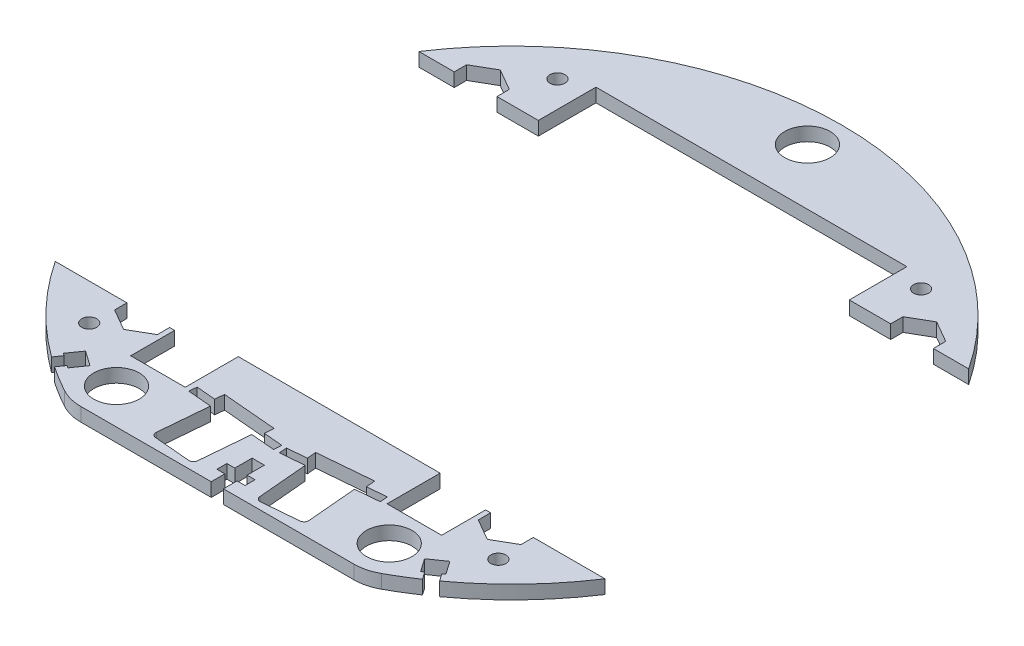
from build123d import *

# Parameters (mm, degrees)
BOSS_EXTRUDE1_DEPTH = 3
CUT_EXTRUDE1_DEPTH  = 103.574363269
SKETCH3_W           = 38.3
SKETCH3_H           = 80
CUT_EXTRUDE2_DEPTH  = 103.574363269
CUT_EXTRUDE3_DEPTH  = 95.453692358
CUT_EXTRUDE4_DEPTH  = 95.453692358
SKETCH6_W           = 68.4
SKETCH6_H           = 3
CUT_EXTRUDE5_DEPTH  = 95.453692358
SKETCH7_R           = 5
CUT_EXTRUDE6_DEPTH  = 95.453692358
CUT_EXTRUDE7_DEPTH  = 95.453692358
SKETCH11_R          = 5
CUT_EXTRUDE10_DEPTH = 95.453692358
CUT_EXTRUDE11_DEPTH = 95.453692358
SKETCH13_R          = 1.65
CUT_EXTRUDE12_DEPTH = 95.453692358
CUT_EXTRUDE13_DEPTH = 95.453692358


with BuildPart() as part:
    # Sketch1 → Boss-Extrude1 (new body)
    with BuildSketch(Plane(origin=(0, 0, 0), x_dir=(1, 0, 0), z_dir=(0, 1, 0))):
        with BuildLine():
            Line((-30.029977361, -64.812867647), (30.029977361, -64.812867647))
            ThreePointArc((30.029977361, -64.812867647), (32.509837414, -64.500503794), (34.834773739, -63.582926471))
            ThreePointArc((34.834773739, -63.582926471), (0, 72.5), (-34.834773739, -63.582926471))
            ThreePointArc((-34.834773739, -63.582926471), (-32.509837414, -64.500503794), (-30.029977361, -64.812867647))
        make_face()
    extrude(amount=BOSS_EXTRUDE1_DEPTH)

    # Sketch2 → Cut-Extrude1 (cut, through all)
    with BuildSketch(Plane(origin=(0, 3, 0), x_dir=(1, 0, 0), z_dir=(0, 1, 0))):
        Polygon((-22.2, -49.675685802), (-22.2, -38), (22.2, -38), (22.2, -49.675685802), (34.2, -49.675685802), (34.2, 49.675685802), (22.2, 49.675685802), (22.2, 44), (-22.2, 44), (-22.2, 49.675685802), (-34.2, 49.675685802), (-34.2, -49.675685802), align=None)
    extrude(amount=-CUT_EXTRUDE1_DEPTH, mode=Mode.SUBTRACT)

    # Sketch3 → Cut-Extrude2 (cut, through all)
    with BuildSketch(Plane(origin=(0, 3, 0), x_dir=(1, 0, 0), z_dir=(0, 1, 0))):
        with Locations((-53.35, 0)):
            Rectangle(SKETCH3_W, SKETCH3_H)
        with Locations((53.35, 0)):
            Rectangle(SKETCH3_W, SKETCH3_H)
    extrude(amount=-CUT_EXTRUDE2_DEPTH, mode=Mode.SUBTRACT)


with BuildPart() as cut_extrude2_piece_1:
    # of the separate pieces the step leaves, piece 1, a body of its own (cut_extrude2_pieces)
    add(part.part.solids().sort_by_distance((60.466933112, 0, -40))[0])

    # Sketch6 → Cut-Extrude5 (cut, through all)
    with BuildSketch(Plane(origin=(0, 3, 0), x_dir=(1, 0, 0), z_dir=(0, 1, 0))):
        with Locations((0, 51.175685802)):
            Rectangle(SKETCH6_W, SKETCH6_H)
    extrude(amount=-CUT_EXTRUDE5_DEPTH, mode=Mode.SUBTRACT)


with BuildPart() as cut_extrude2_piece_2:
    # of the separate pieces the step leaves, piece 2, a body of its own (cut_extrude2_pieces)
    add(part.part.solids().sort_by_distance((-34.834773739, 0, 63.582926471))[0])

    # Sketch4 → Cut-Extrude3 (cut, through all)
    with BuildSketch(Plane(origin=(0, 3, 0), x_dir=(1, 0, 0), z_dir=(0, 1, 0))):
        Polygon((-21.070156074, -50.026174921), (-0.648164763, -51.812867647), (-0.5, -50.11933666), (-20.921991311, -48.332643934), align=None)
        Polygon((21.070156074, -50.026174921), (20.921991311, -48.332643934), (0.5, -50.11933666), (0.648164763, -51.812867647), align=None)
    extrude(amount=-CUT_EXTRUDE3_DEPTH, mode=Mode.SUBTRACT)

    # Sketch5 → Cut-Extrude4 (cut, through all)
    with BuildSketch(Plane(origin=(0, 3, 0), x_dir=(1, 0, 0), z_dir=(0, 1, 0))):
        with BuildLine():
            Line((5.878186928, -51.355299998), (15.840133909, -50.48374257))
            Line((15.840133909, -50.48374257), (16.798847079, -61.441884249))
            ThreePointArc((16.798847079, -61.441884249), (16.568696824, -62.171827602), (15.889808123, -62.52523469))
            Line((15.889808123, -62.52523469), (7.920250539, -63.222480632))
            ThreePointArc((7.920250539, -63.222480632), (7.190307186, -62.992330377), (6.836900098, -62.313441677))
            Line((6.836900098, -62.313441677), (5.878186928, -51.355299998))
        make_face()
        Polygon((16.688163844, -48.703055841), (4.733827467, -49.748924754), (4.559515981, -47.756535357), (16.513852358, -46.710666444), align=None)
        Polygon((-16.513852358, -46.710666444), (-4.559515981, -47.756535357), (-4.733827467, -49.748924754), (-16.688163844, -48.703055841), align=None)
        with BuildLine():
            Line((-7.920250539, -63.222480632), (-15.889808123, -62.52523469))
            ThreePointArc((-15.889808123, -62.52523469), (-16.568696824, -62.171827602), (-16.798847079, -61.441884249))
            Line((-16.798847079, -61.441884249), (-15.840133909, -50.48374257))
            Line((-15.840133909, -50.48374257), (-5.878186928, -51.355299998))
            Line((-5.878186928, -51.355299998), (-6.836900098, -62.313441677))
            ThreePointArc((-6.836900098, -62.313441677), (-7.190307186, -62.992330377), (-7.920250539, -63.222480632))
        make_face()
    extrude(amount=-CUT_EXTRUDE4_DEPTH, mode=Mode.SUBTRACT)

    # Sketch7 → Cut-Extrude6 (cut, through all)
    with BuildSketch(Plane(origin=(0, 3, 0), x_dir=(1, 0, 0), z_dir=(0, 1, 0))):
        with Locations(Location((-30, -57, 0), (0, 0, 270))):
            Circle(SKETCH7_R)
        with Locations(Location((30, -57, 0), (0, 0, 270))):
            Circle(SKETCH7_R)
    extrude(amount=-CUT_EXTRUDE6_DEPTH, mode=Mode.SUBTRACT)


with BuildPart() as cut_extrude5_kept_piece:
    # of the separate pieces the step leaves, the one the design keeps (cut_extrude5_pieces_kept)
    add(cut_extrude2_piece_1.part.solids().sort_by_distance((60.466933112, 0, -40))[0])


with BuildPart() as cut_extrude7_tool:
    # Sketch8 → Cut-Extrude7 (new, through all)
    with BuildSketch(Plane(origin=(0, 3, 0), x_dir=(1, 0, 0), z_dir=(0, 1, 0))):
        Polygon((-52.7, 37.286453735), (-52.7, 32.5), (-43.3, 32.5), (-43.3, 37.286453735), (-43.3, 42.713546265), (-48, 45.42709253), (-52.7, 42.713546265), align=None)
        Polygon((44.7, -32.5), (35.3, -32.5), (35.3, -37.286453735), (35.3, -42.713546265), (40, -45.42709253), (44.7, -42.713546265), (44.7, -37.286453735), align=None)
        Polygon((-35.3, -37.286453735), (-35.3, -32.5), (-44.7, -32.5), (-44.7, -37.286453735), (-44.7, -42.713546265), (-40, -45.42709253), (-35.3, -42.713546265), align=None)
        Polygon((52.7, 32.5), (52.7, 37.286453735), (52.7, 42.713546265), (48, 45.42709253), (43.3, 42.713546265), (43.3, 37.286453735), (43.3, 32.5), align=None)
    extrude(amount=-CUT_EXTRUDE7_DEPTH)


with BuildPart() as cut_extrude2_piece_2_1:
    add(cut_extrude2_piece_2.part)

    # Cut-Extrude7: cut by cut_extrude7_tool
    add(cut_extrude7_tool.part, mode=Mode.SUBTRACT)

    # Sketch12 → Cut-Extrude11 (cut, through all)
    with BuildSketch(Plane(origin=(0, 3, 0), x_dir=(1, 0, 0), z_dir=(0, 1, 0))):
        Polygon((-1.35, -64.812867647), (1.35, -64.812867647), (1.35, -61.812867647), (3.1, -61.812867647), (3.1, -59.612867647), (1.35, -59.612867647), (1.35, -55.812867647), (-1.35, -55.812867647), (-1.35, -59.612867647), (-3.1, -59.612867647), (-3.1, -61.812867647), (-1.35, -61.812867647), align=None)
    extrude(amount=-CUT_EXTRUDE11_DEPTH, mode=Mode.SUBTRACT)


with BuildPart() as cut_extrude5_kept_piece_1:
    add(cut_extrude5_kept_piece.part)

    # Cut-Extrude7: cut by cut_extrude7_tool
    add(cut_extrude7_tool.part, mode=Mode.SUBTRACT)

    # Sketch11 → Cut-Extrude10 (cut, through all)
    with BuildSketch(Plane(origin=(0, 3, 0), x_dir=(1, 0, 0), z_dir=(0, 1, 0))):
        with Locations(Location((0, 65, 0), (0, 0, 270))):
            Circle(SKETCH11_R)
    extrude(amount=-CUT_EXTRUDE10_DEPTH, mode=Mode.SUBTRACT)


with BuildPart() as cut_extrude12_tool:
    # Sketch13 → Cut-Extrude12 (new, through all)
    with BuildSketch(Plane(origin=(0, 3, 0), x_dir=(1, 0, 0), z_dir=(0, 1, 0))):
        with Locations(Location((45, -48, 0), (0, 0, 270))):
            Circle(SKETCH13_R)
        with Locations(Location((-45, -48, 0), (0, 0, 90))):
            Circle(SKETCH13_R)
        with Locations(Location((40, 50, 0), (0, 0, 270))):
            Circle(SKETCH13_R)
        with Locations(Location((-40, 50, 0), (0, 0, 90))):
            Circle(SKETCH13_R)
    extrude(amount=-CUT_EXTRUDE12_DEPTH)


with BuildPart() as cut_extrude2_piece_2_2:
    add(cut_extrude2_piece_2_1.part)

    # Cut-Extrude12: cut by cut_extrude12_tool
    add(cut_extrude12_tool.part, mode=Mode.SUBTRACT)

    # Sketch14 → Cut-Extrude13 (cut, through all)
    with BuildSketch(Plane.XZ):
        Polygon((-41.542994023, 56.975890933), (-42.075442851, 56.60306625), (-40.067925324, 53.736034095), (-36.791317147, 56.03033984), (-38.798834674, 58.897371995), (-39.331283503, 58.524547311), (-40.478436376, 60.1628514), (-42.690146895, 58.614195022), align=None)
        Polygon((41.542994023, 56.975890933), (42.690146895, 58.614195022), (40.478436376, 60.1628514), (39.331283503, 58.524547311), (38.798834674, 58.897371995), (36.791317147, 56.03033984), (40.067925324, 53.736034095), (42.075442851, 56.60306625), align=None)
    extrude(amount=-CUT_EXTRUDE13_DEPTH, mode=Mode.SUBTRACT)


with BuildPart() as cut_extrude5_kept_piece_2:
    add(cut_extrude5_kept_piece_1.part)

    # Cut-Extrude12: cut by cut_extrude12_tool
    add(cut_extrude12_tool.part, mode=Mode.SUBTRACT)


solid = Compound([cut_extrude2_piece_2_2.part, cut_extrude5_kept_piece_2.part])
